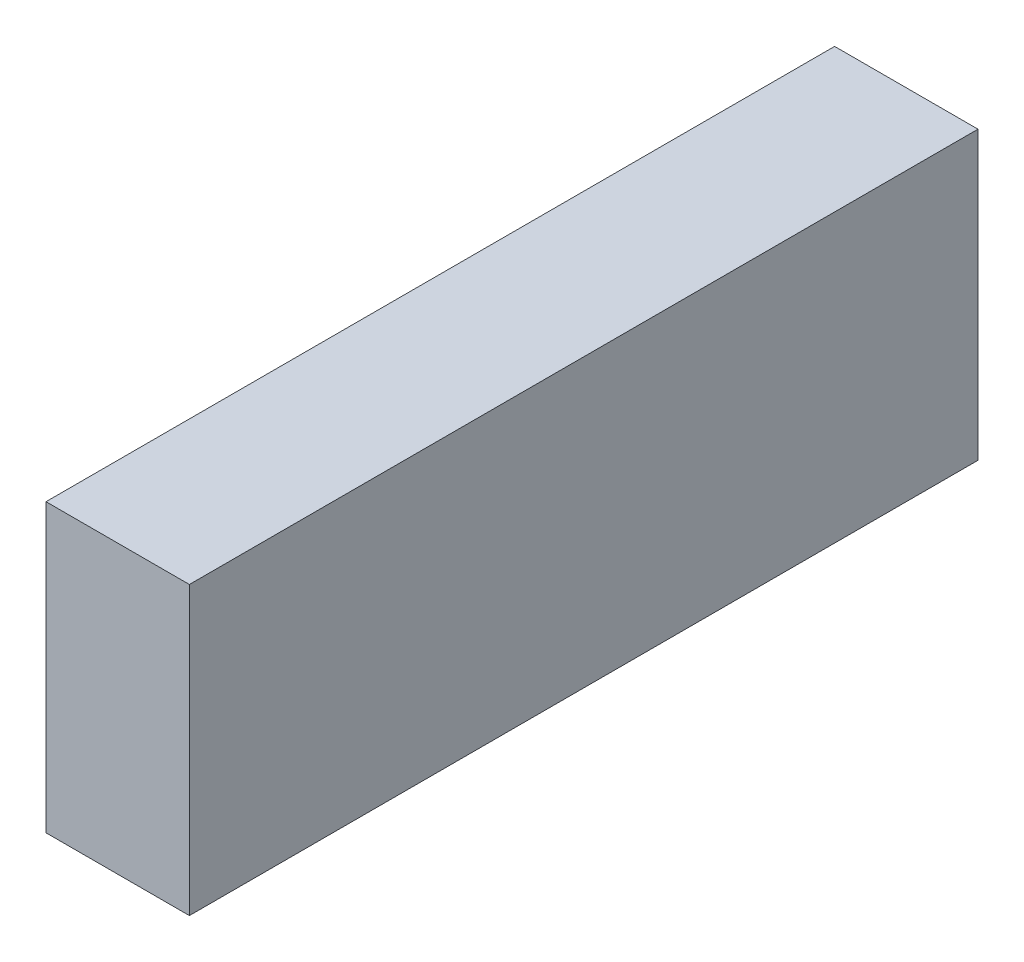
from build123d import *

# Parameters (mm, degrees)
SKETCH1_W           = 25.4
SKETCH1_H           = 139.7
BOSS_EXTRUDE1_DEPTH = 6.35
SKETCH3_W           = 25.4
SKETCH3_H           = 6.35
BOSS_EXTRUDE2_DEPTH = 38.1
BOSS_EXTRUDE3_DEPTH = 6.35
CUT_EXTRUDE2_DEPTH  = 84.521209881
SKETCH8_W           = 12.7
SKETCH8_H           = 139.7
CUT_EXTRUDE3_DEPTH  = 84.521209881
SKETCH9_W           = 6.35
SKETCH9_H           = 127
BOSS_EXTRUDE4_DEPTH = 38.1
SKETCH10_W          = 25.4
SKETCH10_H          = 139.7
BOSS_EXTRUDE5_DEPTH = 6.35


with BuildPart() as part:
    # Sketch1 → Boss-Extrude1 (new body)
    with BuildSketch(Plane(origin=(0, 0, 0), x_dir=(1, 0, 0), z_dir=(0, 1, 0))):
        Rectangle(SKETCH1_W, SKETCH1_H)
    extrude(amount=BOSS_EXTRUDE1_DEPTH)

    # Sketch3 → Boss-Extrude2 (add)
    with BuildSketch(Plane(origin=(0, 6.35, 0), x_dir=(1, 0, 0), z_dir=(0, 1, 0))):
        with Locations((0, 66.675)):
            Rectangle(SKETCH3_W, SKETCH3_H)
        with Locations((0, -66.675)):
            Rectangle(SKETCH3_W, SKETCH3_H)
    extrude(amount=BOSS_EXTRUDE2_DEPTH)

    # Sketch6 → Boss-Extrude3 (add)
    with BuildSketch(Plane(origin=(0, 6.35, 0), x_dir=(1, 0, 0), z_dir=(0, 1, 0))):
        Polygon((12.7, 50.8), (19.05, 50.8), (19.05, 57.15), (25.4, 57.15), (25.4, 31.75), (19.05, 31.75), (19.05, 38.1), (12.7, 38.1), align=None)
    boss_extrude3 = extrude(amount=-BOSS_EXTRUDE3_DEPTH)

    # Sketch7 → Cut-Extrude2 (cut, through all)
    with BuildSketch(Plane(origin=(0, 6.35, 0), x_dir=(1, 0, 0), z_dir=(0, 1, 0))):
        Polygon((-12.7, 50.8), (-6.35, 50.8), (-6.35, 57.15), (0, 57.15), (0, 31.75), (-6.35, 31.75), (-6.35, 38.1), (-12.7, 38.1), align=None)
    cut_extrude2 = extrude(amount=-CUT_EXTRUDE2_DEPTH, mode=Mode.SUBTRACT)

    # Mirror1: Boss-Extrude3, Cut-Extrude2 across plane
    add(boss_extrude3.mirror(Plane.XY))
    add(cut_extrude2.mirror(Plane.XY), mode=Mode.SUBTRACT)

    # Sketch8 → Cut-Extrude3 (cut, through all)
    with BuildSketch(Plane(origin=(0, 6.35, 0), x_dir=(1, 0, 0), z_dir=(0, 1, 0))):
        with Locations((19.05, 0)):
            Rectangle(SKETCH8_W, SKETCH8_H)
    extrude(amount=-CUT_EXTRUDE3_DEPTH, mode=Mode.SUBTRACT)

    # Sketch9 → Boss-Extrude4 (add)
    with BuildSketch(Plane(origin=(0, 6.35, 0), x_dir=(1, 0, 0), z_dir=(0, 1, 0))):
        with Locations((9.525, 0)):
            Rectangle(SKETCH9_W, SKETCH9_H)
    extrude(amount=BOSS_EXTRUDE4_DEPTH)

    # Sketch10 → Boss-Extrude5 (add)
    with BuildSketch(Plane(origin=(0, 44.45, 0), x_dir=(1, 0, 0), z_dir=(0, 1, 0))):
        Rectangle(SKETCH10_W, SKETCH10_H)
    extrude(amount=BOSS_EXTRUDE5_DEPTH)


solid = part.part
